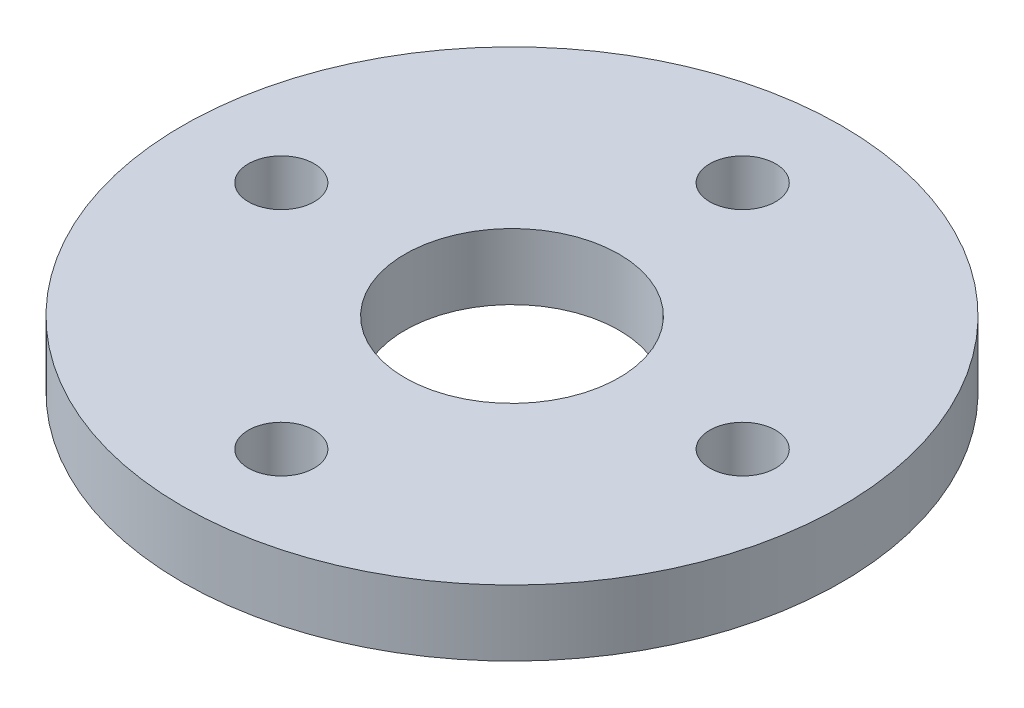
from build123d import *

# Parameters (mm, degrees)
SKETCH1_R           = 10
SKETCH1_R_2         = 3.25
SKETCH1_R_3         = 1
BOSS_EXTRUDE1_DEPTH = 2


with BuildPart() as part:
    # Sketch1 → Boss-Extrude1 (new body)
    with BuildSketch(Plane(origin=(0, 0, 0), x_dir=(1, 0, 0), z_dir=(0, 1, 0))):
        with Locations(Location((0, 0, 0), (0, 0, 270))):
            Circle(SKETCH1_R)
        with Locations(Location((0, 0, 0), (0, 0, 270))):
            Circle(SKETCH1_R_2, mode=Mode.SUBTRACT)
        with Locations(Location((0, 7, 0), (0, 0, 270))):
            Circle(SKETCH1_R_3, mode=Mode.SUBTRACT)
        with Locations(Location((7, 0, 0), (0, 0, 270))):
            Circle(SKETCH1_R_3, mode=Mode.SUBTRACT)
        with Locations(Location((0, -7, 0), (0, 0, 270))):
            Circle(SKETCH1_R_3, mode=Mode.SUBTRACT)
        with Locations(Location((-7, 0, 0), (0, 0, 270))):
            Circle(SKETCH1_R_3, mode=Mode.SUBTRACT)
    extrude(amount=BOSS_EXTRUDE1_DEPTH)


solid = part.part
